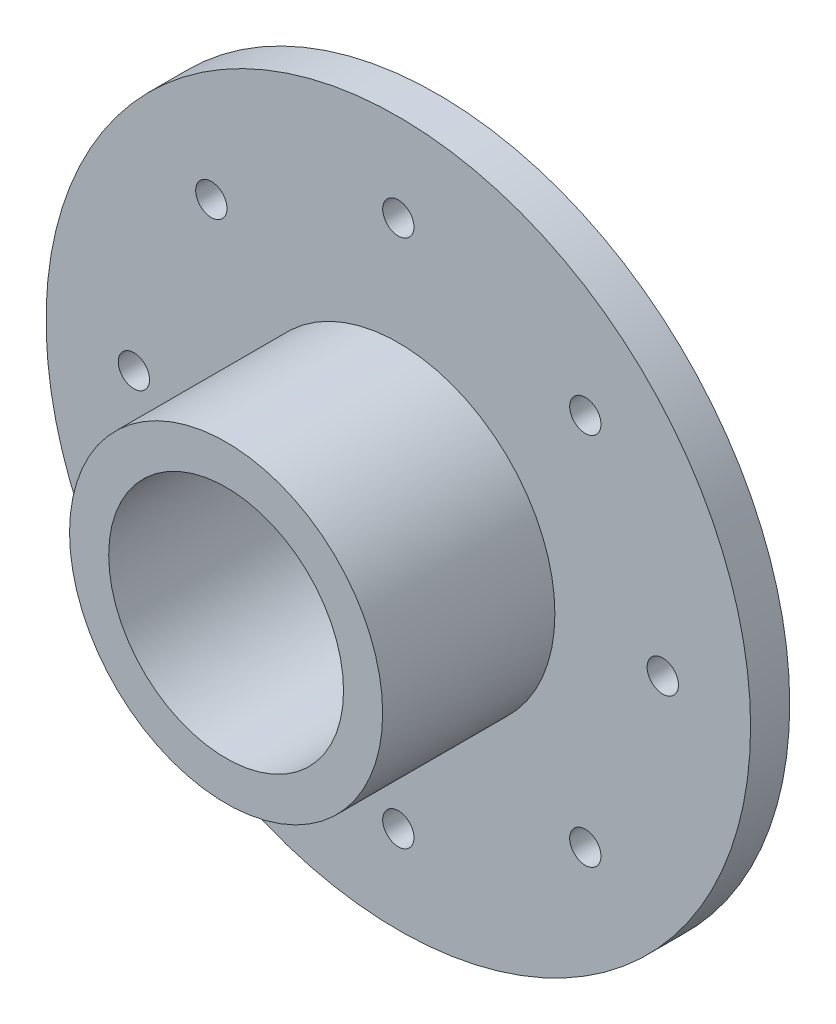
from build123d import *

# Parameters (mm, degrees)
SKETCH_1_R          = 45
EXTRUDE_1_DEPTH     = 5
SKETCH_2_R          = 20
SKETCH_2_R_2        = 15
EXTRUDE_2_DEPTH     = 22
SKETCH_3_R          = 2
CUT_EXTRUDE_3_DEPTH = 68.334983478


with BuildPart() as part:
    # Эскиз1 → Вытянуть1 (new body)
    with BuildSketch(Plane.XY):
        Circle(SKETCH_1_R)
    extrude(amount=EXTRUDE_1_DEPTH)

    # Эскиз2 → Вытянуть2 (add)
    with BuildSketch(Plane.XY.offset(5)):
        Circle(SKETCH_2_R)
        Circle(SKETCH_2_R_2, mode=Mode.SUBTRACT)
    extrude(amount=EXTRUDE_2_DEPTH)

    # Эскиз3 → Вытянуть3 (cut, through all)
    with BuildSketch(Plane.XY.offset(5)):
        with Locations((0, 33.781150957)):
            Circle(SKETCH_3_R)
        with Locations((23.886880918, 23.886880918)):
            Circle(SKETCH_3_R)
        with Locations((33.781150957, 0)):
            Circle(SKETCH_3_R)
        with Locations((23.886880918, -23.886880918)):
            Circle(SKETCH_3_R)
        with Locations((0, -33.781150957)):
            Circle(SKETCH_3_R)
        with Locations((-23.886880918, -23.886880918)):
            Circle(SKETCH_3_R)
        with Locations((-33.781150957, 0)):
            Circle(SKETCH_3_R)
        with Locations((-23.886880918, 23.886880918)):
            Circle(SKETCH_3_R)
    extrude(amount=-CUT_EXTRUDE_3_DEPTH, mode=Mode.SUBTRACT)


solid = part.part
